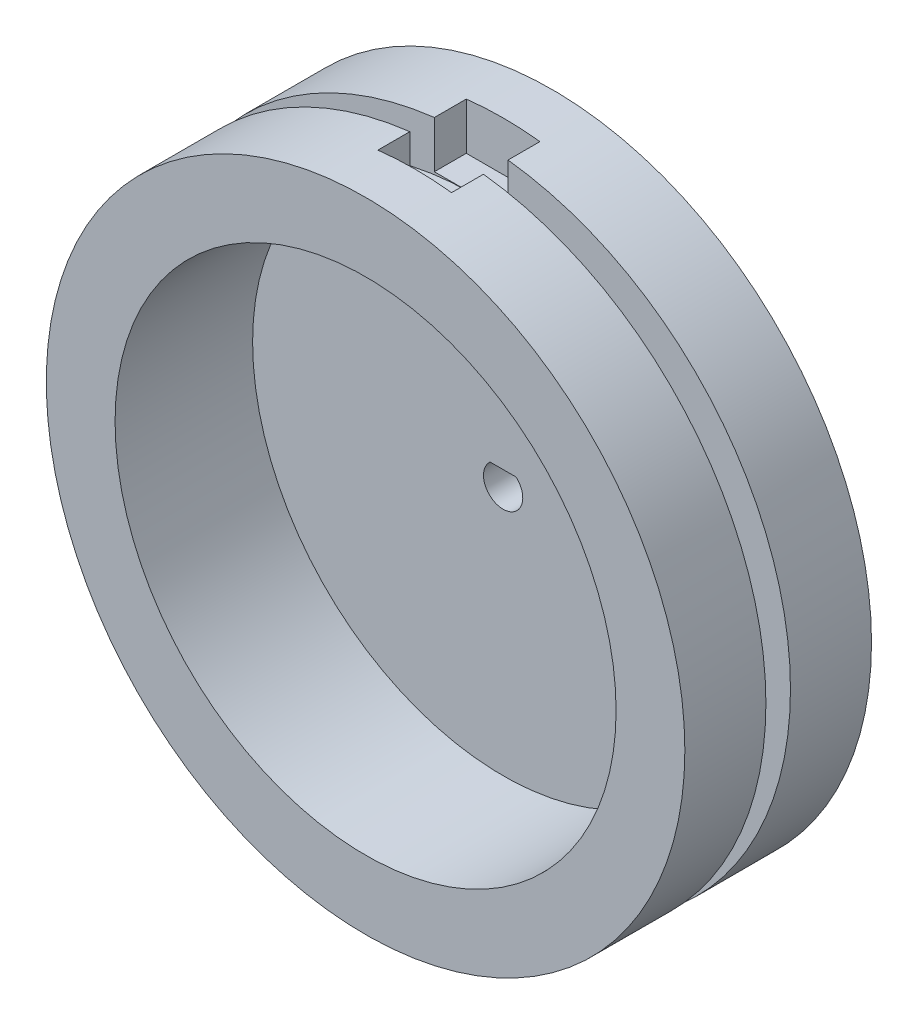
from build123d import *

# Parameters (mm, degrees)
SKETCH7_W          = 7.5
SKETCH7_H          = 9
CUT_EXTRUDE1_DEPTH = 5
SHAFT_HOLE_DEPTH   = 50.734294003


with BuildPart() as part:
    # Sketch2 → Revolve1 (revolve)
    with BuildSketch(Plane(origin=(0, 0, 0), x_dir=(0, 0, -1), z_dir=(1, 0, 0)), mode=Mode.PRIVATE) as revolve1_sk:
        Polygon((0, 0), (0, 32.5), (-8.25, 32.5), (-8.25, 27.5), (-10.75, 27.5), (-10.75, 32.5), (-19, 32.5), (-19, 25.5), (-5, 25.5), (-5, 0), align=None)
    revolve(revolve1_sk.sketch.rotate(Axis((0, 0, 5), (0, 0, -1)), 90), axis=Axis((0, 0, 5), (0, 0, -1)))

    # Sketch7 → Cut-Extrude1 (cut)
    with BuildSketch(Plane(origin=(0, 32.5, 0), x_dir=(1, 0, 0), z_dir=(0, 1, 0))):
        with Locations((0, -9.5)):
            Rectangle(SKETCH7_W, SKETCH7_H)
    cut_extrude1 = extrude(amount=-CUT_EXTRUDE1_DEPTH, mode=Mode.SUBTRACT)

    # Mirror1: Cut-Extrude1 across plane
    add(cut_extrude1.mirror(Plane.ZX), mode=Mode.SUBTRACT)

    # Sketch8 → Shaft Hole (cut, through all)
    with BuildSketch(Plane(origin=(0, 0, 0), x_dir=(-1, 0, 0), z_dir=(0, 0, -1))):
        with BuildLine():
            Line((-1.322875656, 1.5), (1.322875656, 1.5))
            ThreePointArc((1.322875656, 1.5), (0, -2), (-1.322875656, 1.5))
        make_face()
    extrude(amount=-SHAFT_HOLE_DEPTH, mode=Mode.SUBTRACT)


solid = part.part
